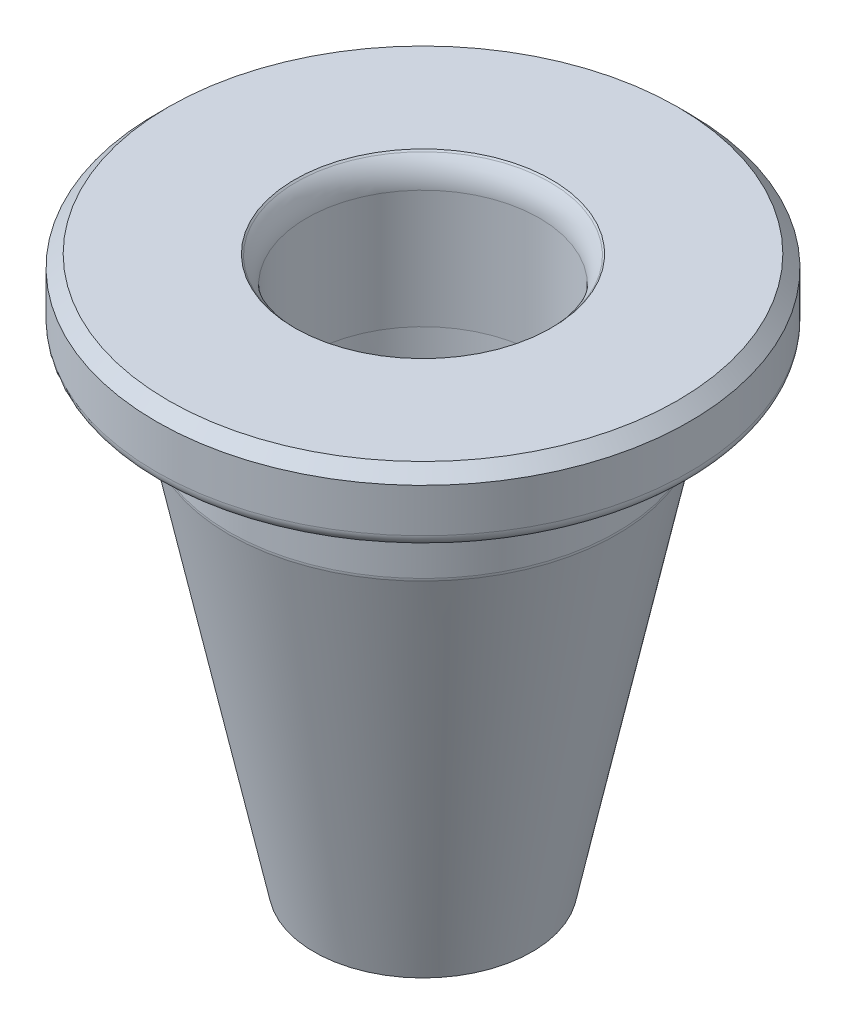
from build123d import *

# Parameters (mm, degrees)
FL_CHE_VERSCHIEBEN2_BY          = 1
AUFSATZ_LINEAR_START            = -2.8
SKIZZE2_R                       = 11
SKIZZE2_R_2                     = 4.8
AUFSATZ_LINEAR_AUSTRAGEN1_DEPTH = 2.8
VERRUNDUNG1_R                   = 0.5
FASE1_SIZE                      = 0.5
VERRUNDUNG2_R                   = 1.5


with BuildPart() as part:
    # Skizze1 → Rotation1 (revolve)
    with BuildSketch(Plane.XY, mode=Mode.PRIVATE) as rotation1_sk:
        Polygon((4, 0), (4.8, 17), (4.8, 22), (8, 22), (8, 17), (4.5, 0.3), align=None)
    revolve(rotation1_sk.sketch.rotate(Axis((0, 0, 0), (0, 1, 0)), 90), axis=Axis((0, 0, 0), (0, 1, 0)))

    # Fläche verschieben2: a face moved outward by 1.0
    extrude(part.faces().sort_by_distance((6.4, 22, 0))[0], amount=FL_CHE_VERSCHIEBEN2_BY, dir=(0, 1, 0))

    # Skizze2 → Aufsatz-Linear austragen1 (add)
    with BuildSketch(Plane(origin=(0, 23, 0), x_dir=(1, 0, 0), z_dir=(0, 1, 0)).offset(AUFSATZ_LINEAR_START)):
        with Locations(Location((0, 0, 0), (0, 0, 270))):
            Circle(SKIZZE2_R)
        with Locations(Location((0, 0, 0), (0, 0, 90))):
            Circle(SKIZZE2_R_2, mode=Mode.SUBTRACT)
    extrude(amount=AUFSATZ_LINEAR_AUSTRAGEN1_DEPTH)

    # Verrundung1
    verrundung1_edges = [part.edges().sort_by_distance(p)[0] for p in [
        (0, 20.2, 8),
        (0, 20.2, -11),
        (0, 17, 8),
    ]]
    fillet(verrundung1_edges, radius=VERRUNDUNG1_R)

    # Fase1
    fase1_edges = [part.edges().sort_by_distance(p)[0] for p in [
        (0, 23, -11),
        (0, 23, 4.8),
    ]]
    chamfer(fase1_edges, length=FASE1_SIZE)

    # Verrundung2
    verrundung2_edges = [part.edges().sort_by_distance(p)[0] for p in [
        (0, 22.5, 4.8),
    ]]
    fillet(verrundung2_edges, radius=VERRUNDUNG2_R)


solid = part.part
